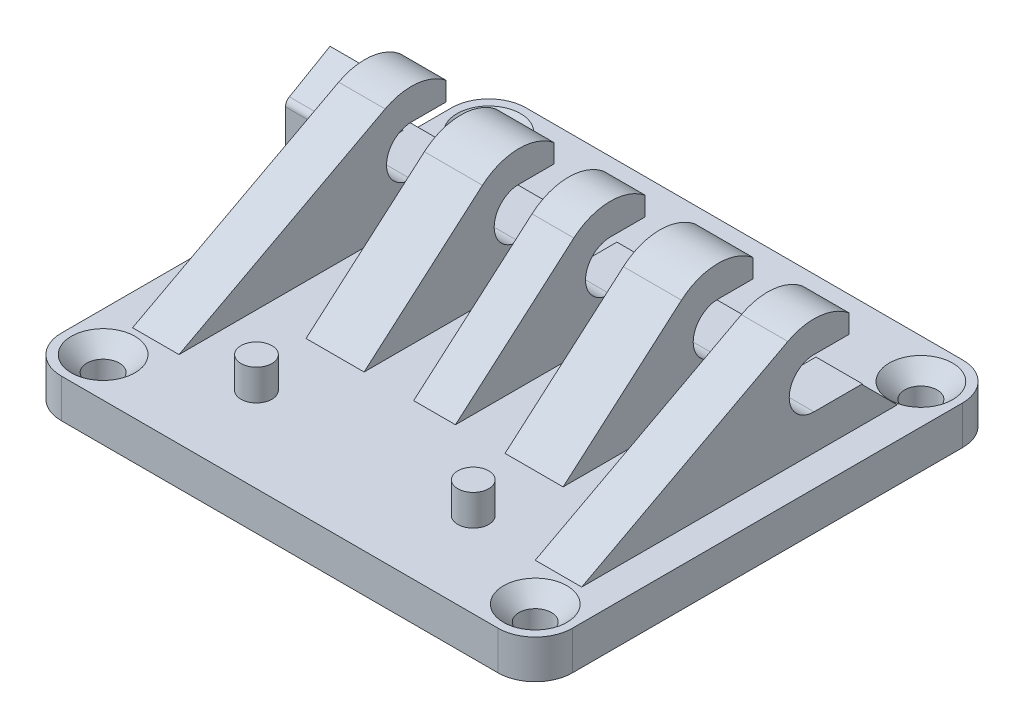
from build123d import *

# Parameters (mm, degrees)
SKETCH4_W           = 6.4
SKETCH4_H           = 40
SKETCH4_W_2         = 5.4
SKETCH4_W_3         = 7.5
BOSS_EXTRUDE4_DEPTH = 5
SKETCH6_W           = 5.4
SKETCH6_H           = 40
SKETCH6_W_2         = 7.5
BOSS_EXTRUDE5_DEPTH = 15
SKETCH7_R           = 3.2
CUT_EXTRUDE2_DEPTH  = 73.625684162
CUT_EXTRUDE3_REACH  = 74.626
CUT_EXTRUDE4_REACH  = 90.566
CUT_EXTRUDE5_REACH  = 92.449
SKETCH10_R          = 2.1
CHAMFER1_SIZE       = 2
FILLET1_R           = 4.8
SKETCH11_R          = 2
BOSS_EXTRUDE6_DEPTH = 4
BOSS_EXTRUDE7_DEPTH = 4
CUT_EXTRUDE6_DEPTH  = 89.566359302
CHAMFER2_SIZE       = 4.5


with BuildPart() as part:
    # Sketch4 → Boss-Extrude4 (new body)
    with BuildSketch(Plane(origin=(0, 0, 0), x_dir=(1, 0, 0), z_dir=(0, 1, 0))):
        Polygon((0, 60), (0, 0), (66, 0), (66, 60), (56, 60), (56, 50), (62, 50), (62, 10), (56, 10), (56, 20), (49.6, 20), (42.1, 20), (35.7, 20), (30.3, 20), (30.3, 60), align=None)
        with Locations((38.9, 40)):
            Rectangle(SKETCH4_W, SKETCH4_H)
        with Locations((33, 40)):
            Rectangle(SKETCH4_W_2, SKETCH4_H)
        with Locations((45.85, 40)):
            Rectangle(SKETCH4_W_3, SKETCH4_H)
        Polygon((56, 50), (56, 60), (49.6, 60), (49.6, 20), (56, 20), align=None)
        Polygon((62, 50), (56, 50), (56, 20), (56, 10), (62, 10), align=None)
    extrude(amount=BOSS_EXTRUDE4_DEPTH)

    # Sketch6 → Boss-Extrude5 (add)
    with BuildSketch(Plane(origin=(0, 5, 0), x_dir=(1, 0, 0), z_dir=(0, 1, 0))):
        with Locations((33, 40)):
            Rectangle(SKETCH6_W, SKETCH6_H)
        with Locations((45.85, 40)):
            Rectangle(SKETCH6_W_2, SKETCH6_H)
        Polygon((62, 50), (56, 50), (56, 20), (56, 10), (62, 10), align=None)
    boss_extrude5 = extrude(amount=BOSS_EXTRUDE5_DEPTH)

    # Sketch7 → Cut-Extrude2 (cut, through all)
    with BuildSketch(Plane.ZY.offset(-30.3)):
        with Locations(Location((-40, 12.8, 0), (0, 0, 180))):
            Circle(SKETCH7_R)
    cut_extrude2 = extrude(amount=-CUT_EXTRUDE2_DEPTH, mode=Mode.SUBTRACT)

    # Cut-Extrude3: up to this face of the body (flat: up to its plane)
    cut_extrude3_end = Plane(part.part.faces().sort_by_distance((49.6, 12.5, -20.427200187))[0])
    # Sketch8 → Cut-Extrude3 (cut, up to the picked face)
    with BuildSketch(Plane.ZY.offset(-30.3), mode=Mode.PRIVATE) as cut_extrude3_sk1:
        with BuildLine():
            Line((-60, 20), (-60, 5))
            Line((-60, 5), (-44.714360106, 18.241948989))
            ThreePointArc((-44.714360106, 18.241948989), (-42.515747134, 19.546185319), (-40, 20))
            Line((-40, 20), (-60, 20))
        make_face()
    cut_extrude3_tool1 = split(extrude(cut_extrude3_sk1.sketch, amount=-CUT_EXTRUDE3_REACH, mode=Mode.PRIVATE), bisect_by=cut_extrude3_end, keep=Keep.BOTH, mode=Mode.PRIVATE)
    # Sketch8 → Cut-Extrude3 (cut, up to the picked face)
    with BuildSketch(Plane.ZY.offset(-30.3), mode=Mode.PRIVATE) as cut_extrude3_sk2:
        with BuildLine():
            Line((-35.285639894, 18.241948989), (-20, 5))
            Line((-20, 5), (-20, 20))
            Line((-20, 20), (-40, 20))
            ThreePointArc((-40, 20), (-37.484252866, 19.546185319), (-35.285639894, 18.241948989))
        make_face()
    cut_extrude3_tool2 = split(extrude(cut_extrude3_sk2.sketch, amount=-CUT_EXTRUDE3_REACH, mode=Mode.PRIVATE), bisect_by=cut_extrude3_end, keep=Keep.BOTH, mode=Mode.PRIVATE)
    cut_extrude3_1 = cut_extrude3_tool1.solids().sort_by(Axis((30.3, 15.029403, -54.154339), (1, 0, 0)))[0]
    add(cut_extrude3_1, mode=Mode.SUBTRACT)
    cut_extrude3_2 = cut_extrude3_tool2.solids().sort_by(Axis((30.3, 15.029403, -25.845661), (1, 0, 0)))[0]
    add(cut_extrude3_2, mode=Mode.SUBTRACT)
    cut_extrude3 = cut_extrude3_1 + cut_extrude3_2  # Cut-Extrude3 as one shape, for the pattern or mirror that repeats it

    # Sketch9 → Cut-Extrude4 (cut, up to next)
    with BuildSketch(Plane(origin=(62, 0, 0), x_dir=(0, 0, -1), z_dir=(1, 0, 0)), mode=Mode.PRIVATE) as cut_extrude4_sk1:
        with BuildLine():
            ThreePointArc((36.619205024, 19.156903753), (38.257832819, 19.786047059), (40, 20))
            Line((40, 20), (10, 20))
            Line((10, 20), (10, 5))
            Line((10, 5), (36.619205024, 19.156903753))
        make_face()
    cut_extrude4_tool1 = extrude(cut_extrude4_sk1.sketch, amount=-CUT_EXTRUDE4_REACH, mode=Mode.PRIVATE) & part.part
    # Sketch9 → Cut-Extrude4 (cut, up to next)
    with BuildSketch(Plane(origin=(62, 0, 0), x_dir=(0, 0, -1), z_dir=(1, 0, 0)), mode=Mode.PRIVATE) as cut_extrude4_sk2:
        with BuildLine():
            ThreePointArc((40, 20), (44.259746459, 18.604701552), (46.868488023, 14.959600029))
            Line((46.868488023, 14.959600029), (50, 5))
            Line((50, 5), (50, 20))
            Line((50, 20), (40, 20))
        make_face()
    cut_extrude4_tool2 = extrude(cut_extrude4_sk2.sketch, amount=-CUT_EXTRUDE4_REACH, mode=Mode.PRIVATE) & part.part
    cut_extrude4_1 = cut_extrude4_tool1.solids().sort_by_distance((62, 15.005893, -19.424487))[0]
    add(cut_extrude4_1, mode=Mode.SUBTRACT)
    cut_extrude4_2 = cut_extrude4_tool2.solids().sort_by_distance((62, 15.504148, -47.92116))[0]
    add(cut_extrude4_2, mode=Mode.SUBTRACT)
    cut_extrude4 = cut_extrude4_1 + cut_extrude4_2  # Cut-Extrude4 as one shape, for the pattern or mirror that repeats it

    # Mirror1: Boss-Extrude5, Cut-Extrude2, Cut-Extrude3, Cut-Extrude4 across plane
    add(boss_extrude5.mirror(Plane.ZY.offset(-33)))
    add(cut_extrude2.mirror(Plane.ZY.offset(-33)), mode=Mode.SUBTRACT)
    add(cut_extrude3.mirror(Plane.ZY.offset(-33)), mode=Mode.SUBTRACT)
    add(cut_extrude4.mirror(Plane.ZY.offset(-33)), mode=Mode.SUBTRACT)

    # Sketch10 → Cut-Extrude5 (cut, up to next)
    with BuildSketch(Plane(origin=(0, 5, 0), x_dir=(1, 0, 0), z_dir=(0, 1, 0)), mode=Mode.PRIVATE) as cut_extrude5_sk1:
        with Locations(Location((5.1, 54.9, 0), (0, 0, 270))):
            Circle(SKETCH10_R)
    cut_extrude5_tool1 = extrude(cut_extrude5_sk1.sketch, amount=-CUT_EXTRUDE5_REACH, mode=Mode.PRIVATE) & part.part
    # Sketch10 → Cut-Extrude5 (cut, up to next)
    with BuildSketch(Plane(origin=(0, 5, 0), x_dir=(1, 0, 0), z_dir=(0, 1, 0)), mode=Mode.PRIVATE) as cut_extrude5_sk2:
        with Locations(Location((60.9, 54.9, 0), (0, 0, 270))):
            Circle(SKETCH10_R)
    cut_extrude5_tool2 = extrude(cut_extrude5_sk2.sketch, amount=-CUT_EXTRUDE5_REACH, mode=Mode.PRIVATE) & part.part
    # Sketch10 → Cut-Extrude5 (cut, up to next)
    with BuildSketch(Plane(origin=(0, 5, 0), x_dir=(1, 0, 0), z_dir=(0, 1, 0)), mode=Mode.PRIVATE) as cut_extrude5_sk3:
        with Locations(Location((60.9, 5.1, 0), (0, 0, 270))):
            Circle(SKETCH10_R)
    cut_extrude5_tool3 = extrude(cut_extrude5_sk3.sketch, amount=-CUT_EXTRUDE5_REACH, mode=Mode.PRIVATE) & part.part
    # Sketch10 → Cut-Extrude5 (cut, up to next)
    with BuildSketch(Plane(origin=(0, 5, 0), x_dir=(1, 0, 0), z_dir=(0, 1, 0)), mode=Mode.PRIVATE) as cut_extrude5_sk4:
        with Locations(Location((5.1, 5.1, 0), (0, 0, 270))):
            Circle(SKETCH10_R)
    cut_extrude5_tool4 = extrude(cut_extrude5_sk4.sketch, amount=-CUT_EXTRUDE5_REACH, mode=Mode.PRIVATE) & part.part
    add(cut_extrude5_tool1.solids().sort_by_distance((5.1, 5, -54.9))[0], mode=Mode.SUBTRACT)
    add(cut_extrude5_tool2.solids().sort_by_distance((60.9, 5, -54.9))[0], mode=Mode.SUBTRACT)
    add(cut_extrude5_tool3.solids().sort_by_distance((60.9, 5, -5.1))[0], mode=Mode.SUBTRACT)
    add(cut_extrude5_tool4.solids().sort_by_distance((5.1, 5, -5.1))[0], mode=Mode.SUBTRACT)

    # Chamfer1
    chamfer1_edges = [part.edges().sort_by_distance(p)[0] for p in [
        (5.1, 5, -7.2),
        (60.9, 5, -7.2),
        (60.9, 5, -57),
        (5.1, 5, -57),
    ]]
    chamfer(chamfer1_edges, length=CHAMFER1_SIZE)

    # Fillet1
    fillet1_edges = [part.edges().sort_by_distance(p)[0] for p in [
        (66, 2.5, 0),
        (0, 2.5, 0),
        (0, 2.5, -60),
        (66, 2.5, -60),
    ]]
    fillet(fillet1_edges, radius=FILLET1_R)

    # Sketch11 → Boss-Extrude6 (add)
    with BuildSketch(Plane(origin=(0, 5, 0), x_dir=(1, 0, 0), z_dir=(0, 1, 0))):
        with Locations(Location((19, 11, 0), (0, 0, 270))):
            Circle(SKETCH11_R)
        with Locations(Location((47, 11, 0), (0, 0, 270))):
            Circle(SKETCH11_R)
    extrude(amount=BOSS_EXTRUDE6_DEPTH)

    # Sketch12 → Boss-Extrude7 (add)
    with BuildSketch(Plane.ZY.offset(-4)):
        with BuildLine():
            Line((-39.5, 19.72820323), (-40, 18.862177826))
            Line((-40, 18.862177826), (-34.75, 15.831088913))
            Line((-34.75, 15.831088913), (-34.75, 9.768911087))
            Line((-34.75, 9.768911087), (-40, 6.737822174))
            Line((-40, 6.737822174), (-44.957437416, 9.6))
            Line((-44.957437416, 9.6), (-46.25, 9.6))
            Line((-46.25, 9.6), (-46.25, 5))
            Line((-46.25, 5), (-33.75, 5))
            Line((-33.75, 5), (-33.75, 15.831088913))
            ThreePointArc((-33.75, 15.831088913), (-33.883974596, 16.331088913), (-34.25, 16.697114317))
            Line((-34.25, 16.697114317), (-39.5, 19.72820323))
        make_face()
    extrude(amount=BOSS_EXTRUDE7_DEPTH)

    # Sketch15 → Cut-Extrude6 (cut, through all)
    with BuildSketch(Plane.ZY.offset(-4)):
        with BuildLine():
            ThreePointArc((-40, 9.6), (-43.2, 12.8), (-40, 16))
            Line((-40, 16), (-44.5, 16))
            Line((-44.5, 16), (-46.449806199, 16))
            ThreePointArc((-46.449806199, 16), (-46.679434726, 15.487964236), (-46.868488023, 14.959600029))
            Line((-46.868488023, 14.959600029), (-48.553661286, 9.6))
            Line((-48.553661286, 9.6), (-46.25, 9.6))
            Line((-46.25, 9.6), (-44.957437416, 9.6))
            Line((-44.957437416, 9.6), (-40, 9.6))
        make_face()
        with BuildLine():
            ThreePointArc((-46.868488023, 14.959600029), (-46.679434726, 15.487964236), (-46.449806199, 16))
            Line((-46.449806199, 16), (-47.302319396, 16))
            Line((-47.302319396, 16), (-54.690060838, 9.6))
            Line((-54.690060838, 9.6), (-48.553661286, 9.6))
            Line((-48.553661286, 9.6), (-46.868488023, 14.959600029))
        make_face()
        Polygon((-48.553661286, 9.6), (-54.690060838, 9.6), (-60, 5), (-55.2, 5), (-50, 5), align=None)
        Polygon((-46.25, 5), (-46.25, 9.6), (-48.553661286, 9.6), (-50, 5), align=None)
        with BuildLine():
            Line((-46.449806199, 16), (-44.5, 16))
            Line((-44.5, 16), (-44.5, 18.420498199))
            ThreePointArc((-44.5, 18.420498199), (-44.608044921, 18.332261925), (-44.714360106, 18.241948989))
            ThreePointArc((-44.714360106, 18.241948989), (-45.693525809, 17.207239937), (-46.449806199, 16))
        make_face()
        with BuildLine():
            Line((-47.302319396, 16), (-46.449806199, 16))
            ThreePointArc((-46.449806199, 16), (-45.693525809, 17.207239937), (-44.714360106, 18.241948989))
            Line((-44.714360106, 18.241948989), (-47.302319396, 16))
        make_face()
    extrude(amount=-CUT_EXTRUDE6_DEPTH, mode=Mode.SUBTRACT)

    # Chamfer2
    chamfer2_edges = [part.edges().sort_by_distance(p)[0] for p in [
        (5, 5, -46.25),
        (33, 5, -46.25),
        (45.85, 5, -46.25),
        (20.15, 5, -46.25),
        (59, 5, -46.25),
    ]]
    chamfer(chamfer2_edges, length=CHAMFER2_SIZE)


solid = part.part
